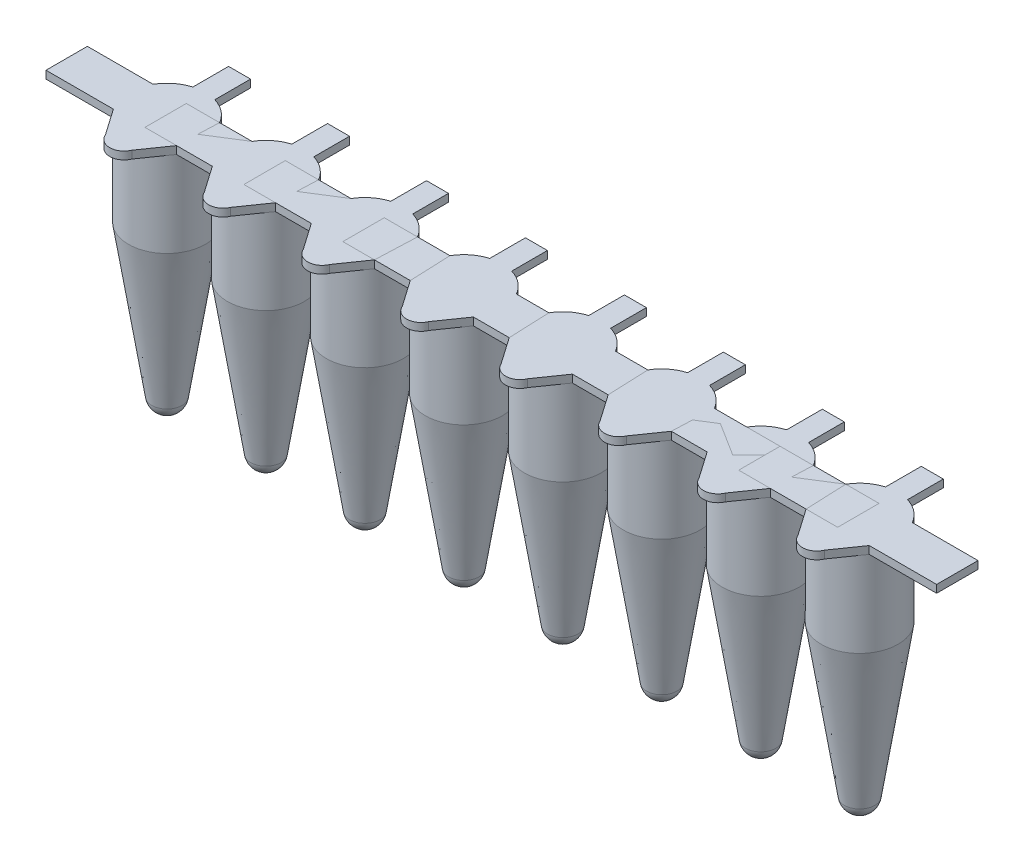
from build123d import *

# Parameters (mm, degrees)
BOSS_EXTRUDE1_DEPTH = 0.7
LPATTERN3_COUNT     = 8
LPATTERN3_PITCH     = 9


with BuildPart() as part:
    # Sketch1 → Revolve1 (revolve)
    with BuildSketch(Plane.XY, mode=Mode.PRIVATE) as revolve1_sk:
        with BuildLine():
            Line((-3.5, 22), (0, 22))
            Line((0, 22), (0, -1.4))
            ThreePointArc((0, -1.4), (-0.91154763, -1.062582194), (-1.383706115, -0.212972741))
            Line((-1.383706115, -0.212972741), (-3.5, 13.536809416))
            Line((-3.5, 13.536809416), (-3.5, 22))
        make_face()
    revolve(revolve1_sk.sketch.rotate(Axis((0, -1.4, 0), (0, 1, 0)), 180), axis=Axis((0, -1.4, 0), (0, 1, 0)))

    # Sketch2 → Boss-Extrude1 (add)
    with BuildSketch(Plane(origin=(0, 22, 0), x_dir=(1, 0, 0), z_dir=(0, 1, 0))):
        with BuildLine():
            Line((-2.871821691, -2.000659935), (-1.199526741, -4.401134311))
            ThreePointArc((-1.199526741, -4.401134311), (0, -5.2), (1.199526741, -4.401134311))
            Line((1.199526741, -4.401134311), (2.871821691, -2.000659935))
            Line((2.871821691, -2.000659935), (9, -2.000659935))
            Line((9, -2.000659935), (9, 1.762974999))
            Line((9, 1.762974999), (3.023560675, 1.762974999))
            ThreePointArc((3.023560675, 1.762974999), (2.163372687, 2.751330336), (1, 3.354101966))
            Line((1, 3.354101966), (1, 6.604101966))
            Line((1, 6.604101966), (-1, 6.604101966))
            Line((-1, 6.604101966), (-1, 3.354101966))
            ThreePointArc((-1, 3.354101966), (-2.163372687, 2.751330336), (-3.023560675, 1.762974999))
            Line((-3.023560675, 1.762974999), (-9, 1.762974999))
            Line((-9, 1.762974999), (-9, -2.000659935))
            Line((-9, -2.000659935), (-2.871821691, -2.000659935))
        make_face()
    extrude(amount=-BOSS_EXTRUDE1_DEPTH)


with BuildPart() as lpattern3_1:
    # LPattern3: pattern copy
    add(part.part.moved(Location(Vector(1, 0, 0) * (1 * LPATTERN3_PITCH))))


with BuildPart() as lpattern3_2:
    # LPattern3: pattern copy
    add(part.part.moved(Location(Vector(1, 0, 0) * (2 * LPATTERN3_PITCH))))


with BuildPart() as lpattern3_3:
    # LPattern3: pattern copy
    add(part.part.moved(Location(Vector(1, 0, 0) * (3 * LPATTERN3_PITCH))))


with BuildPart() as lpattern3_4:
    # LPattern3: pattern copy
    add(part.part.moved(Location(Vector(1, 0, 0) * (4 * LPATTERN3_PITCH))))


with BuildPart() as lpattern3_5:
    # LPattern3: pattern copy
    add(part.part.moved(Location(Vector(1, 0, 0) * (5 * LPATTERN3_PITCH))))


with BuildPart() as lpattern3_6:
    # LPattern3: pattern copy
    add(part.part.moved(Location(Vector(1, 0, 0) * (6 * LPATTERN3_PITCH))))


with BuildPart() as lpattern3_7:
    # LPattern3: pattern copy
    add(part.part.moved(Location(Vector(1, 0, 0) * (7 * LPATTERN3_PITCH))))


solid = Compound([part.part, lpattern3_1.part, lpattern3_2.part, lpattern3_3.part, lpattern3_4.part, lpattern3_5.part, lpattern3_6.part, lpattern3_7.part])
